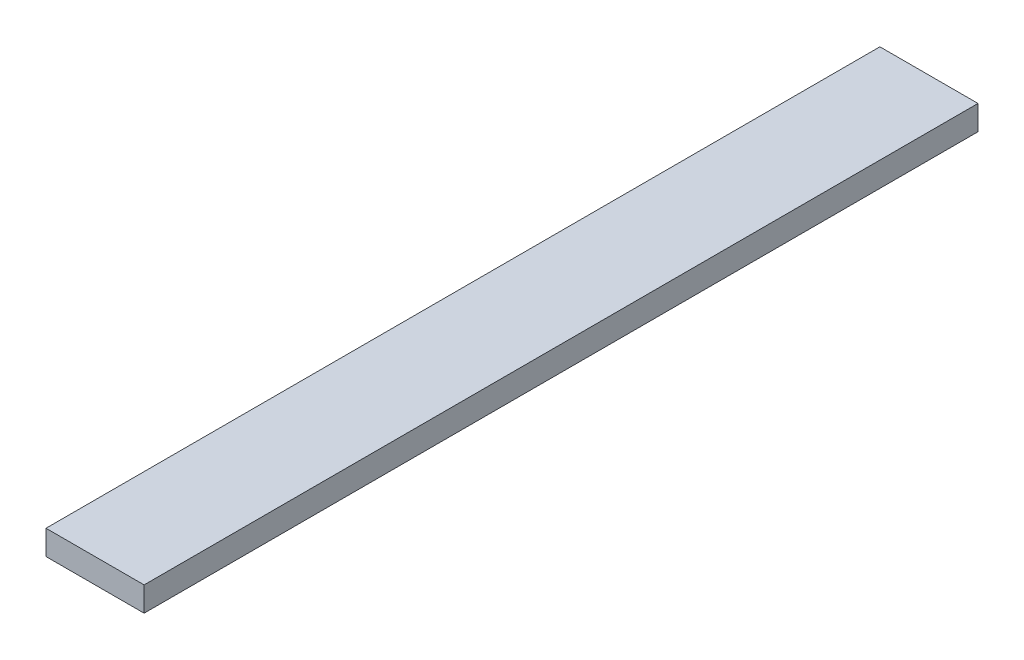
from build123d import *

# Parameters (mm, degrees)
SZKIC1_W                    = 20
SZKIC1_H                    = 170
DODANIE_WYCI_GNI_CIE1_DEPTH = 5


with BuildPart() as part:
    # Szkic1 → Dodanie-wyciągnięcie1 (new body)
    with BuildSketch(Plane(origin=(0, 0, 0), x_dir=(1, 0, 0), z_dir=(0, 1, 0))):
        Rectangle(SZKIC1_W, SZKIC1_H)
    extrude(amount=DODANIE_WYCI_GNI_CIE1_DEPTH)


solid = part.part
